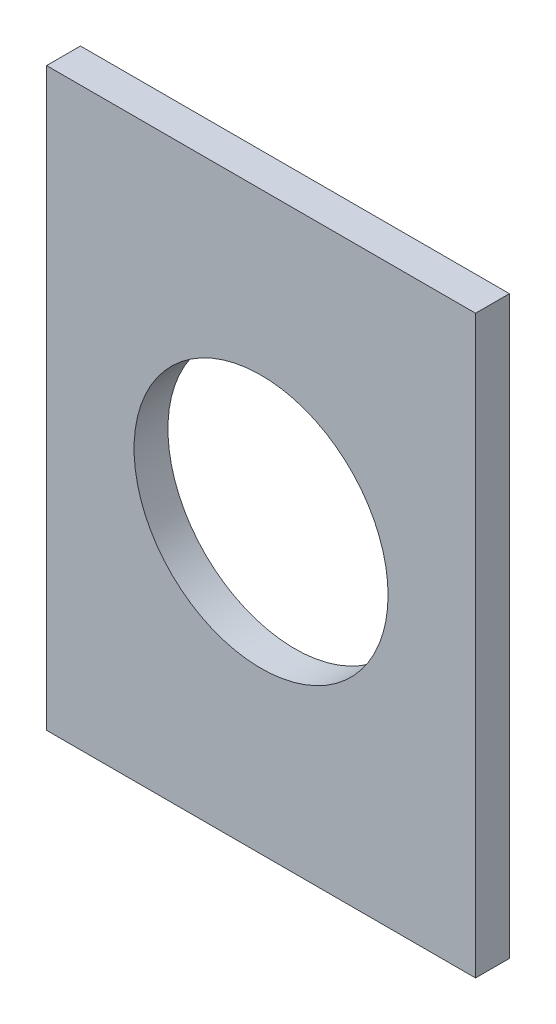
from build123d import *

# Parameters (mm, degrees)
ESQUISSE1_W          = 38
ESQUISSE1_H          = 51
ESQUISSE1_R          = 11.25
BASE_EXTRUSION_DEPTH = 3


with BuildPart() as part:
    # Esquisse1 → Base-Extrusion (new body)
    with BuildSketch(Plane.XY):
        Rectangle(ESQUISSE1_W, ESQUISSE1_H)
        Circle(ESQUISSE1_R, mode=Mode.SUBTRACT)
    extrude(amount=BASE_EXTRUSION_DEPTH)


solid = part.part
